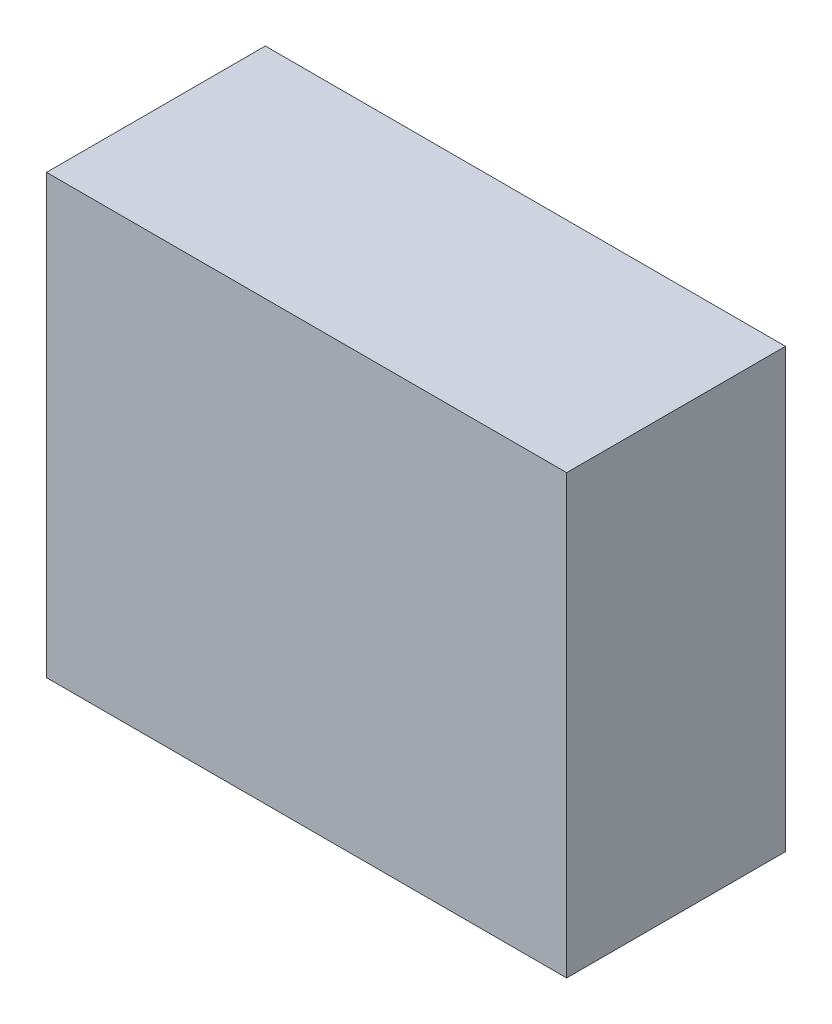
from build123d import *

# Parameters (mm, degrees)
SKETCH_1_W      = 12.2
SKETCH_1_H      = 6.1
EXTRUDE_1_DEPTH = 14.5


with BuildPart() as part:
    # ｽｹｯﾁ1 → ﾎﾞｽ - 押し出し1 (new body)
    with BuildSketch(Plane.YZ):
        Rectangle(SKETCH_1_W, SKETCH_1_H)
    extrude(amount=EXTRUDE_1_DEPTH)


solid = part.part
